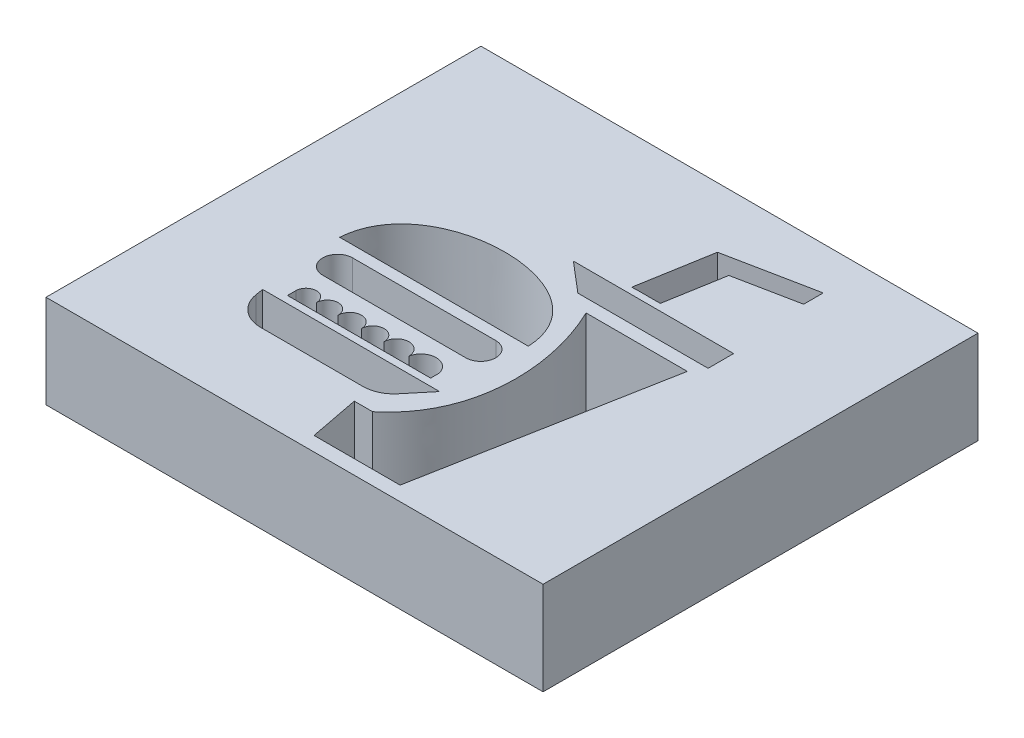
from build123d import *

# Parameters (mm, degrees)
SKETCH1_W           = 16
SKETCH1_H           = 14
BOSS_EXTRUDE1_DEPTH = 3


with BuildPart() as part:
    # Sketch1 → Boss-Extrude1 (new body)
    with BuildSketch(Plane(origin=(0, 0, 0), x_dir=(1, 0, 0), z_dir=(0, 1, 0))):
        with Locations((-34.802547771, 15.318471338)):
            Rectangle(SKETCH1_W, SKETCH1_H)
        with BuildLine():
            Line((-39.747765047, 14.717010334), (-33.675750706, 14.717010334))
            add(Edge.make_bspline(
                [(-39.747765047, 14.717010334), (-39.561120933, 17.701061711), (-33.79747245, 17.731175732), (-33.675750706, 14.717010334)],
                knots=[0, 0, 0, 0, 1, 1, 1, 1], degree=3))
        make_face(mode=Mode.SUBTRACT)
        with BuildLine():
            Line((-38.965889228, 14.351025908), (-34.357812591, 14.351025908))
            ThreePointArc((-34.357812591, 14.351025908), (-33.875378575, 13.868591892), (-34.357812591, 13.386157876))
            Line((-34.357812591, 13.386157876), (-38.965889228, 13.386157876))
            ThreePointArc((-38.965889228, 13.386157876), (-39.448323244, 13.868591892), (-38.965889228, 14.351025908))
        make_face(mode=Mode.SUBTRACT)
        with BuildLine():
            Line((-39.533825085, 12.024167234), (-33.838965327, 12.024167234))
            Line((-33.838965327, 12.024167234), (-34.443549741, 11.294520332))
            ThreePointArc((-34.443549741, 11.294520332), (-34.788137861, 11.027556057), (-35.213561017, 10.932550609))
            Line((-35.213561017, 10.932550609), (-38.507427743, 10.932550609))
            ThreePointArc((-38.507427743, 10.932550609), (-39.157744536, 11.172887481), (-39.495471122, 11.778374472))
            Line((-39.495471122, 11.778374472), (-39.533825085, 12.024167234))
        make_face(mode=Mode.SUBTRACT)
        with BuildLine():
            Line((-38.965889228, 12.521103778), (-38.965889228, 12.254933286))
            Line((-38.965889228, 12.254933286), (-34.357812591, 12.254933286))
            Line((-34.357812591, 12.254933286), (-34.357812591, 12.521103778))
            ThreePointArc((-34.357812591, 12.521103778), (-34.840246607, 12.916411942), (-35.322680624, 12.521103778))
            ThreePointArc((-35.322680624, 12.521103778), (-35.721936361, 12.920359515), (-36.121192098, 12.521103778))
            ThreePointArc((-36.121192098, 12.521103778), (-36.487176524, 12.887088204), (-36.85316095, 12.521103778))
            ThreePointArc((-36.85316095, 12.521103778), (-37.227463204, 12.895406032), (-37.601765458, 12.521103778))
            ThreePointArc((-37.601765458, 12.521103778), (-37.951114229, 12.870452548), (-38.300462999, 12.521103778))
            ThreePointArc((-38.300462999, 12.521103778), (-38.633176113, 12.853816892), (-38.965889228, 12.521103778))
        make_face(mode=Mode.SUBTRACT)
        with BuildLine():
            Line((-34.945417172, 10.384522547), (-34.635673461, 8.779972828))
            Line((-34.635673461, 8.779972828), (-31.865915017, 8.779972828))
            Line((-31.865915017, 8.779972828), (-30.414179557, 16.573500036))
            Line((-30.414179557, 16.573500036), (-33.675750706, 16.573500036))
            add(Edge.make_bspline(
                [(-33.675750706, 16.573500036), (-32.735887192, 14.661705952), (-32.525301104, 11.881425098), (-34.357812591, 10.384522547)],
                knots=[0, 0, 0, 0, 1, 1, 1, 1], degree=3))
            Line((-34.357812591, 10.384522547), (-34.945417172, 10.384522547))
        make_face(mode=Mode.SUBTRACT)
        Polygon((-34.357812591, 16.993739248), (-30.165856386, 16.993739248), (-30.165856386, 17.815115891), (-35.322680624, 17.815115891), align=None, mode=Mode.SUBTRACT)
        with BuildLine():
            Line((-33.473024699, 18.033096236), (-32.744268505, 18.033096236))
            Line((-32.744268505, 18.033096236), (-32.419866706, 19.916311952))
            Line((-32.419866706, 19.916311952), (-30.414179557, 20.317449381))
            Line((-30.414179557, 20.317449381), (-30.414179557, 20.9478082))
            Line((-30.414179557, 20.9478082), (-33.250794239, 20.380485263))
            Line((-33.250794239, 20.380485263), (-33.655154301, 18.033096236))
            ThreePointArc((-33.655154301, 18.033096236), (-33.5640895, 18.025310185), (-33.473024699, 18.033096236))
        make_face(mode=Mode.SUBTRACT)
    extrude(amount=BOSS_EXTRUDE1_DEPTH)


solid = part.part
